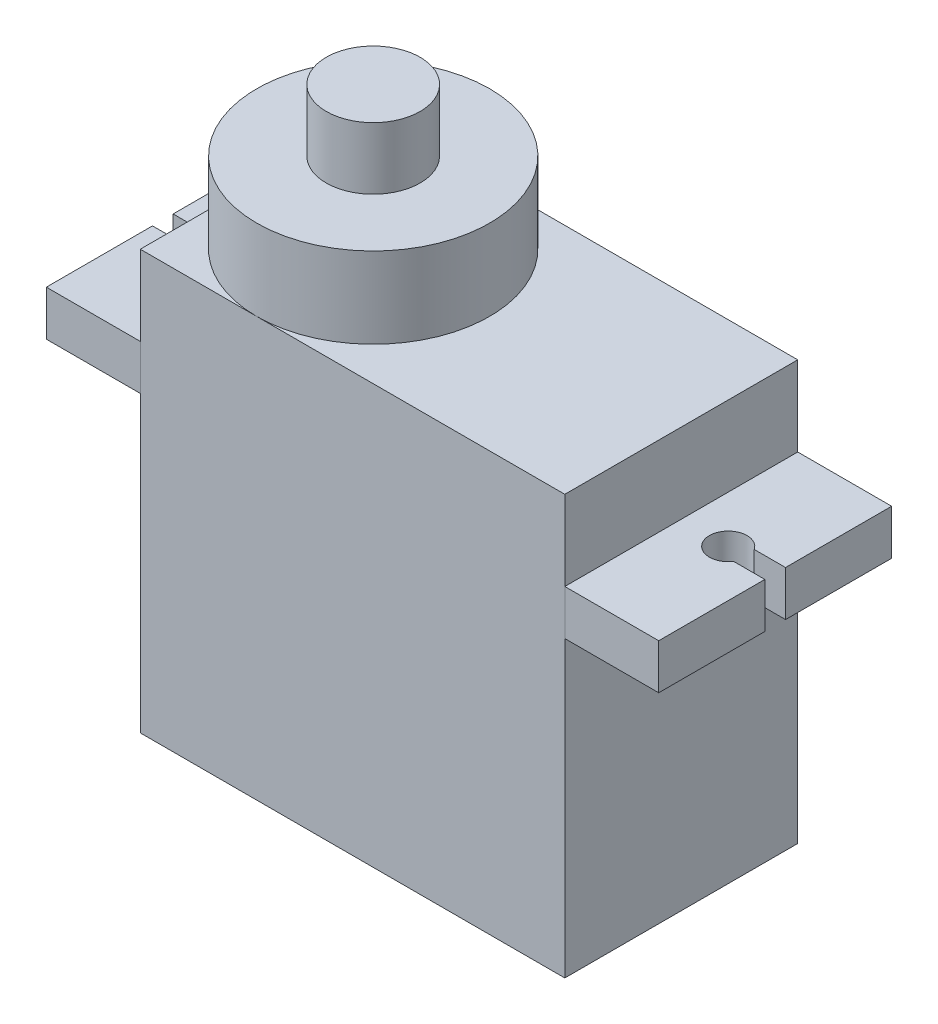
from build123d import *

# Parameters (mm, degrees)
SKETCH_1_W          = 22.6
SKETCH_1_H          = 12.4
EXTRUDE_1_DEPTH     = 22.3
SKETCH_2_W          = 5
SKETCH_2_H          = 2.4
EXTRUDE_2_DEPTH     = 12.4
EXTRUDE_2_2_DEPTH   = 12.4
CUT_EXTRUDE_1_DEPTH = 26.098456128
SKETCH_4_R          = 6.2
EXTRUDE_3_DEPTH     = 4.3
SKETCH_5_R          = 2.5
EXTRUDE_4_DEPTH     = 3.3


with BuildPart() as part:
    # 草图1 → 凸台-拉伸1 (new body)
    with BuildSketch(Plane(origin=(0, 0, 0), x_dir=(1, 0, 0), z_dir=(0, 1, 0))):
        Rectangle(SKETCH_1_W, SKETCH_1_H)
    extrude(amount=EXTRUDE_1_DEPTH)

    # 草图4 → 凸台-拉伸3 (add)
    with BuildSketch(Plane(origin=(0, 22.3, 0), x_dir=(1, 0, 0), z_dir=(0, 1, 0))):
        with Locations(Location((-5.1, 0, 0), (0, 0, 270))):
            Circle(SKETCH_4_R)
    extrude(amount=EXTRUDE_3_DEPTH)

    # 草图5 → 凸台-拉伸4 (add)
    with BuildSketch(Plane(origin=(0, 26.6, 0), x_dir=(1, 0, 0), z_dir=(0, 1, 0))):
        with Locations(Location((-5.1, 0, 0), (0, 0, 270))):
            Circle(SKETCH_5_R)
    extrude(amount=EXTRUDE_4_DEPTH)


with BuildPart() as body_2:
    # 草图2 → 凸台-拉伸2 (new, through all)
    with BuildSketch(Plane.XY.offset(6.2)):
        with Locations((13.8, 16.85)):
            Rectangle(SKETCH_2_W, SKETCH_2_H)
    extrude(amount=-EXTRUDE_2_DEPTH)


with BuildPart() as body_3:
    # 草图2 → Extrude 2 2 (new, through all)
    with BuildSketch(Plane.XY.offset(6.2)):
        with Locations((-13.8, 16.85)):
            Rectangle(SKETCH_2_W, SKETCH_2_H)
    extrude(amount=-EXTRUDE_2_2_DEPTH)


with BuildPart() as cut_extrude_1_tool:
    # 草图3 → 切除-拉伸1 (new, through all)
    with BuildSketch(Plane(origin=(0, 18.05, 0), x_dir=(1, 0, 0), z_dir=(0, 1, 0))):
        with BuildLine():
            Line((14.635164654, 0.55), (16.3, 0.55))
            Line((16.3, 0.55), (16.3, -0.55))
            Line((16.3, -0.55), (14.635164654, -0.55))
            ThreePointArc((14.635164654, -0.55), (12.8, 0), (14.635164654, 0.55))
        make_face()
        with BuildLine():
            Line((-14.635164654, -0.55), (-16.3, -0.55))
            Line((-16.3, -0.55), (-16.3, 0.55))
            Line((-16.3, 0.55), (-14.635164654, 0.55))
            ThreePointArc((-14.635164654, 0.55), (-12.8, 0), (-14.635164654, -0.55))
        make_face()
    extrude(amount=-CUT_EXTRUDE_1_DEPTH)


with BuildPart() as body_2_1:
    add(body_2.part)

    # 切除-拉伸1: cut by cut_extrude_1_tool
    add(cut_extrude_1_tool.part, mode=Mode.SUBTRACT)


with BuildPart() as body_3_1:
    add(body_3.part)

    # 切除-拉伸1: cut by cut_extrude_1_tool
    add(cut_extrude_1_tool.part, mode=Mode.SUBTRACT)


solid = Compound([part.part, body_2_1.part, body_3_1.part])
